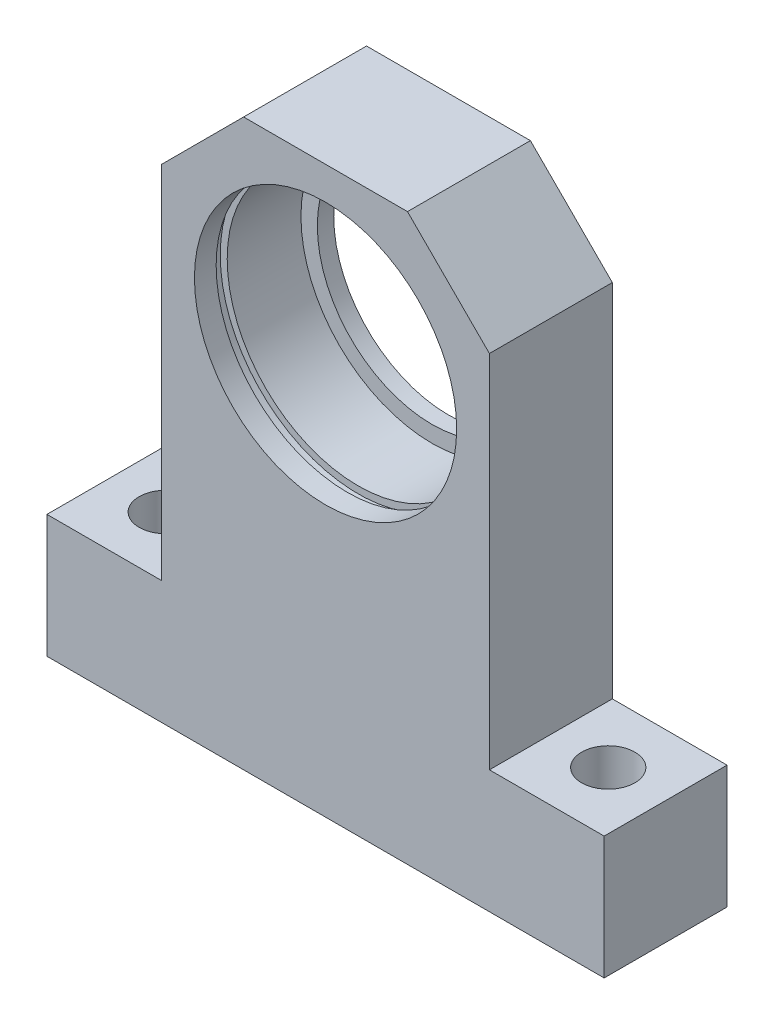
from build123d import *

# Parameters (mm, degrees)
BOSS_EXTRUDE1_DEPTH = 15
DIAMETER_HOLE1_D    = 6.5
CHAMFER1_SIZE       = 10


with BuildPart() as part:
    # Sketch1 → Boss-Extrude1 (new body)
    with BuildSketch(Plane.XY):
        Polygon((-20, 69), (20, 69), (20, 15), (34, 15), (34, 0), (-34, 0), (-34, 15), (-20, 15), align=None)
    extrude(amount=-BOSS_EXTRUDE1_DEPTH)

    # Sketch2 → Cut-Revolve1 (revolve, cut)
    with BuildSketch(Plane(origin=(0, 0, 0), x_dir=(0, 0, -1), z_dir=(1, 0, 0))):
        Polygon((2.65, 65), (2.65, 65.85), (4, 65.85), (4, 65), (13, 65), (13, 63), (15, 63), (15, 49), (0, 49), (0, 65), align=None)
    revolve(axis=Axis((0, 49, -15), (0, 0, 1)), mode=Mode.SUBTRACT)

    # Diameter Hole1 (through all)
    with Locations(Plane(origin=(0, 15, 0), x_dir=(1, 0, 0), z_dir=(0, 1, 0))):
        with Locations((-27, 7.5), (27, 7.5)):
            Hole(DIAMETER_HOLE1_D / 2)

    # Chamfer1
    chamfer1_edges = [part.edges().sort_by_distance(p)[0] for p in [
        (-20, 69, -7.5),
        (20, 69, -7.5),
    ]]
    chamfer(chamfer1_edges, length=CHAMFER1_SIZE)


solid = part.part
